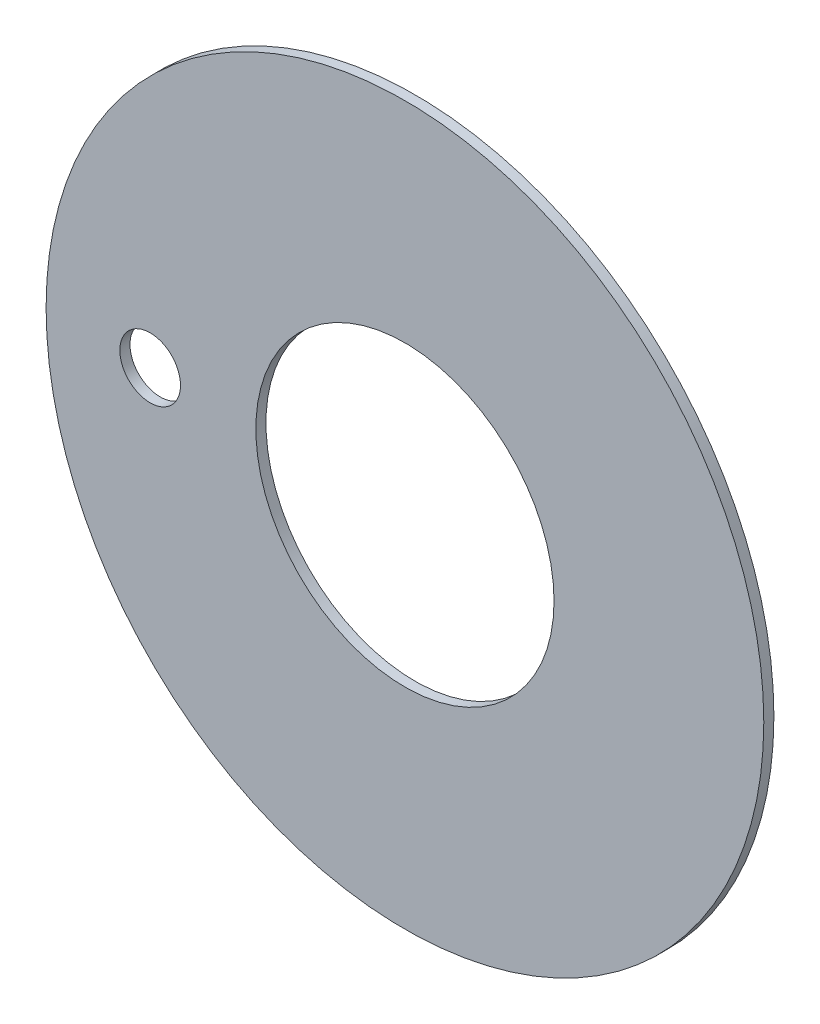
from build123d import *

# Parameters (mm, degrees)
ESBO_O2_R                = 35.5
RESSALTO_EXTRUS_O1_DEPTH = 1
ESBO_O3_R                = 14.75
CORTE_EXTRUS_O1_DEPTH    = 1
ESBO_O7_R                = 3
CORTE_EXTRUS_O3_DEPTH    = 1


with BuildPart() as part:
    # Esboço2 → Ressalto-extrusão1 (new body)
    with BuildSketch(Plane.XY):
        Circle(ESBO_O2_R)
    extrude(amount=RESSALTO_EXTRUS_O1_DEPTH)

    # Esboço3 → Corte-extrusão1 (cut)
    with BuildSketch(Plane.XY.offset(1)):
        Circle(ESBO_O3_R)
    extrude(amount=-CORTE_EXTRUS_O1_DEPTH, mode=Mode.SUBTRACT)

    # Esboço7 → Corte-extrusão3 (cut)
    with BuildSketch(Plane.XY.offset(1)):
        with Locations((-25.203573784, 0)):
            Circle(ESBO_O7_R)
    extrude(amount=-CORTE_EXTRUS_O3_DEPTH, mode=Mode.SUBTRACT)


solid = part.part
